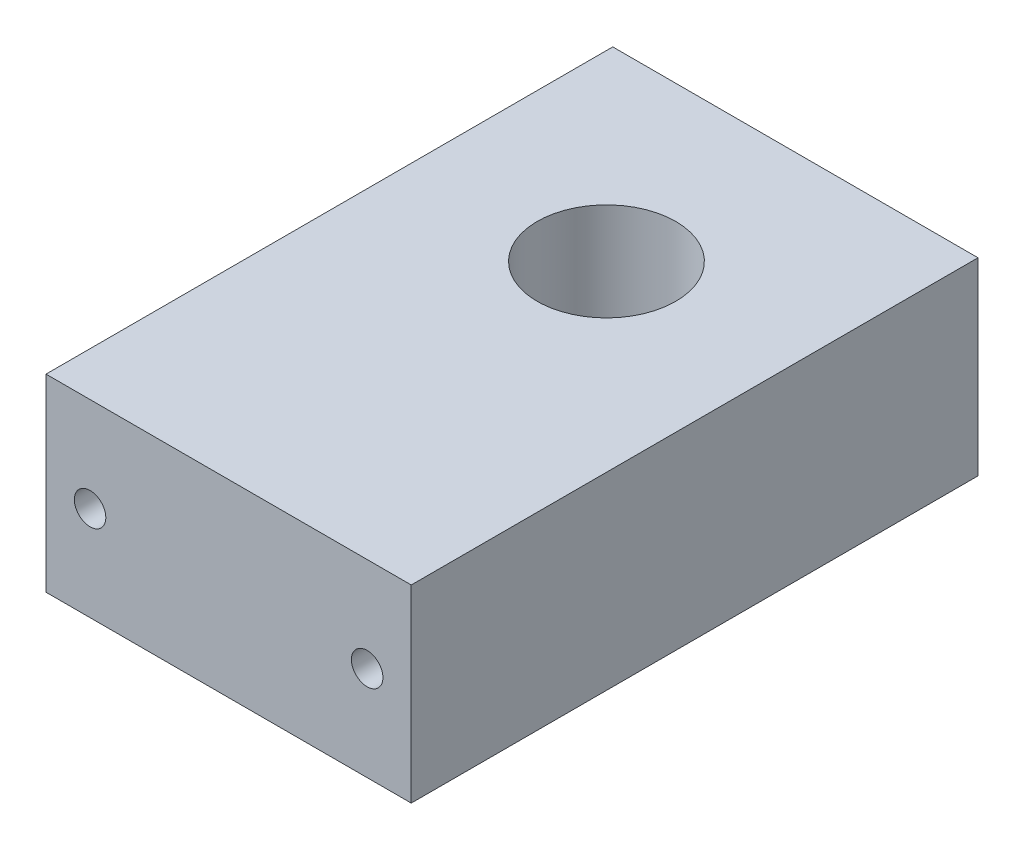
from build123d import *

# Parameters (mm, degrees)
BOSS_EXTRUDE1_DEPTH = 90
SKETCH3_R           = 11
CUT_EXTRUDE1_DEPTH  = 92.815774412
M6_TAPPED_HOLE_D    = 5


with BuildPart() as part:
    # Sketch1 → Boss-Extrude1 (new body)
    with BuildSketch(Plane(origin=(0, 2.518676762, -14.699029015), x_dir=(1, 0, 0), z_dir=(0, 0, 1))):
        Polygon((-43.126560257, 671.967635092), (-14.126560257, 671.967635092), (14.873439743, 671.967635092), (14.873439743, 701.967635092), (-43.126560257, 701.967635092), align=None)
    extrude(amount=BOSS_EXTRUDE1_DEPTH)

    # Sketch3 → Cut-Extrude1 (cut, through all)
    with BuildSketch(Plane.XZ.offset(-674.486311854)):
        with Locations(Location((-14.126560257, 15.300970985, 0), (0, 0, 270))):
            Circle(SKETCH3_R)
    extrude(amount=-CUT_EXTRUDE1_DEPTH, mode=Mode.SUBTRACT)

    # M6 Tapped Hole (through all)
    with Locations(Plane(origin=(545.719230148, 1586.957920749, 85.300970985), x_dir=(-1, 0, 0), z_dir=(0, 0, 1))):
        with Locations((514.845790405, 897.471608895), (537.845790405, 897.471608895), (581.845790405, 897.471608895), (604.845790405, 897.471608895), (514.845790405, 1450.886073068), (514.845790405, 1412.886073068), (537.845790405, 1453.886073068), (537.845790405, 1409.886073068), (581.845790405, 1453.886073068), (581.845790405, 1409.886073068), (604.845790405, 1450.886073068), (604.845790405, 1412.886073068), (514.845790405, 1431.886073068), (537.845790405, 1431.886073068), (581.845790405, 1431.886073068), (604.845790405, 1431.886073068)):
            Hole(M6_TAPPED_HOLE_D / 2)


solid = part.part
